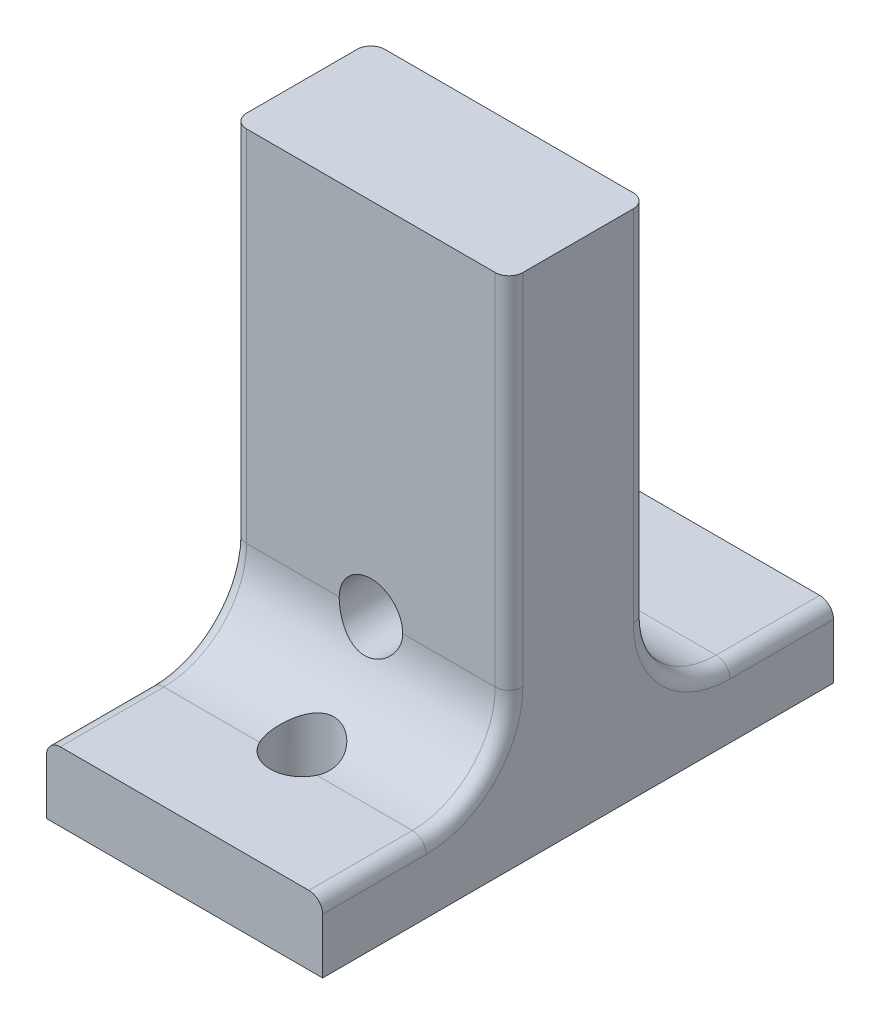
from build123d import *

# Parameters (mm, degrees)
BOSS_EXTRUDE1_DEPTH     = 25.4
FILLET1_R               = 7.62
SKETCH2_R               = 2.921
CUT_EXTRUDE1_DEPTH      = 59.354392508
FILLET2_R               = 1.27
CUT_EXTRUDE2_DEPTH      = 62.187777579
CUT_EXTRUDE2_DEPTH_BACK = 62.187777579
SKETCH3_R               = 2.921


with BuildPart() as part:
    # Sketch1 → Boss-Extrude1 (new body)
    with BuildSketch(Plane(origin=(0, 0, 0), x_dir=(0, 0, -1), z_dir=(1, 0, 0))):
        Polygon((-6.35, 46.99), (6.35, 46.99), (6.35, 6.35), (23.495, 6.35), (23.495, 0), (-23.495, 0), (-23.495, 6.35), (-6.35, 6.35), align=None)
    extrude(amount=BOSS_EXTRUDE1_DEPTH)

    # Fillet1
    fillet1_edges = [part.edges().sort_by_distance(p)[0] for p in [
        (12.7, 6.35, -6.35),
        (12.7, 6.35, 6.35),
    ]]
    fillet(fillet1_edges, radius=FILLET1_R)

    # Sketch2 → Cut-Extrude1 (cut, through all)
    with BuildSketch(Plane.XZ):
        with Locations(Location((12.7, 12.7, 0), (0, 0, 270))):
            Circle(SKETCH2_R)
        with Locations(Location((12.7, -12.7, 0), (0, 0, 334.228538259))):
            Circle(SKETCH2_R)
    extrude(amount=-CUT_EXTRUDE1_DEPTH, mode=Mode.SUBTRACT)

    # Fillet2
    fillet2_edges = [part.edges().sort_by_distance(p)[0] for p in [
        (0, 30.48, 6.35),
        (25.4, 30.48, 6.35),
        (0, 6.35, 18.7325),
        (25.4, 6.35, 18.7325),
        (0, 30.48, -6.35),
        (25.4, 30.48, -6.35),
        (0, 8.581846327, 8.581846327),
        (25.4, 8.581846327, 8.581846327),
        (0, 8.581846327, -8.581846327),
        (25.4, 8.581846327, -8.581846327),
        (25.4, 6.35, -18.7325),
        (0, 6.35, -18.7325),
    ]]
    fillet(fillet2_edges, radius=FILLET2_R)

    # Sketch3 → Cut-Extrude2 (cut, two sides: drawn at the far end of the back side and taken through both)
    with BuildSketch(Plane(origin=(0, 0, -6.35), x_dir=(-1, 0, 0), z_dir=(0, 0, -1)).offset(-CUT_EXTRUDE2_DEPTH_BACK)):
        with Locations((-12.7, 13.97)):
            Circle(SKETCH3_R)
    extrude(amount=CUT_EXTRUDE2_DEPTH + CUT_EXTRUDE2_DEPTH_BACK, mode=Mode.SUBTRACT)


solid = part.part
